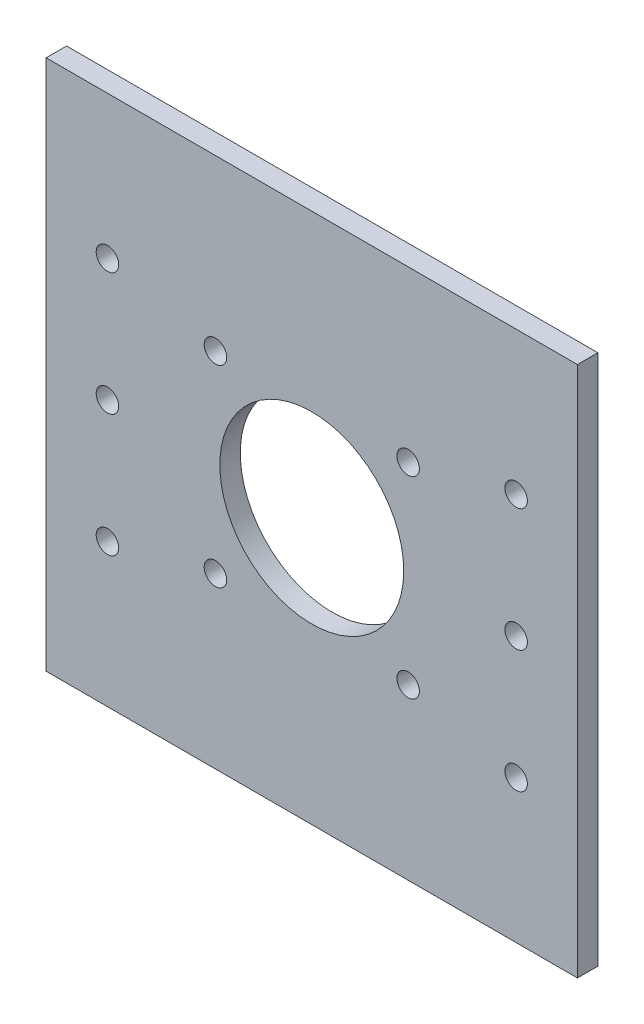
from build123d import *

# Parameters (mm, degrees)
SKETCH_1_W      = 130
SKETCH_1_H      = 130
SKETCH_1_R      = 22.5
SKETCH_1_R_2    = 2.75
EXTRUDE_1_DEPTH = 5


with BuildPart() as part:
    # 草图1 → 凸台-拉伸1 (new body)
    with BuildSketch(Plane.XY):
        Rectangle(SKETCH_1_W, SKETCH_1_H)
        Circle(SKETCH_1_R, mode=Mode.SUBTRACT)
        with Locations((-23.571404551, 23.571404551)):
            Circle(SKETCH_1_R_2, mode=Mode.SUBTRACT)
        with Locations((23.571404551, 23.571404551)):
            Circle(SKETCH_1_R_2, mode=Mode.SUBTRACT)
        with Locations((23.571404551, -23.571404551)):
            Circle(SKETCH_1_R_2, mode=Mode.SUBTRACT)
        with Locations((-23.571404551, -23.571404551)):
            Circle(SKETCH_1_R_2, mode=Mode.SUBTRACT)
        with Locations((-50, 30)):
            Circle(SKETCH_1_R_2, mode=Mode.SUBTRACT)
        with Locations((-50, 0)):
            Circle(SKETCH_1_R_2, mode=Mode.SUBTRACT)
        with Locations(Location((-50, -30, 0), (0, 0, 180))):
            Circle(SKETCH_1_R_2, mode=Mode.SUBTRACT)
        with Locations((50, -30)):
            Circle(SKETCH_1_R_2, mode=Mode.SUBTRACT)
        with Locations(Location((50, 0, 0), (0, 0, 180))):
            Circle(SKETCH_1_R_2, mode=Mode.SUBTRACT)
        with Locations(Location((50, 30, 0), (0, 0, 180))):
            Circle(SKETCH_1_R_2, mode=Mode.SUBTRACT)
    extrude(amount=EXTRUDE_1_DEPTH)


solid = part.part
